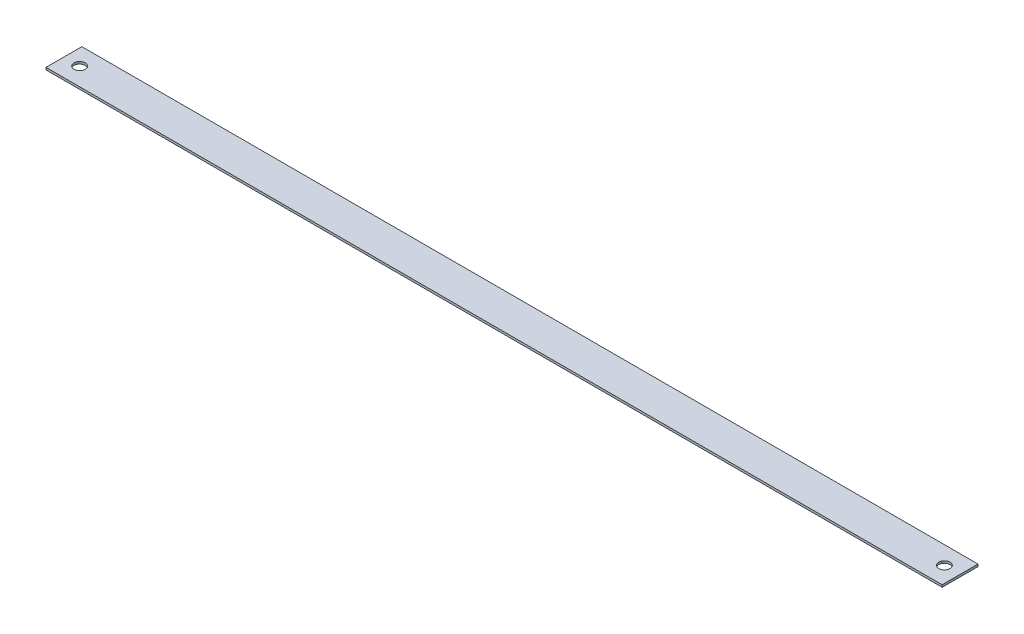
from build123d import *

# Parameters (mm, degrees)
SKETCH_1_W      = 400
SKETCH_1_H      = 16
SKETCH_1_R      = 2.5
EXTRUDE_1_DEPTH = 1


with BuildPart() as part:
    # Эскиз1 → Бобышка-Вытянуть1 (new body)
    with BuildSketch(Plane(origin=(0, 0, 0), x_dir=(1, 0, 0), z_dir=(0, 1, 0))):
        with Locations((-200, 8)):
            Rectangle(SKETCH_1_W, SKETCH_1_H)
        with Locations(Location((-393, 8, 0), (0, 0, 270))):
            Circle(SKETCH_1_R, mode=Mode.SUBTRACT)
        with Locations(Location((-7, 8, 0), (0, 0, 270))):
            Circle(SKETCH_1_R, mode=Mode.SUBTRACT)
    extrude(amount=EXTRUDE_1_DEPTH)


solid = part.part
